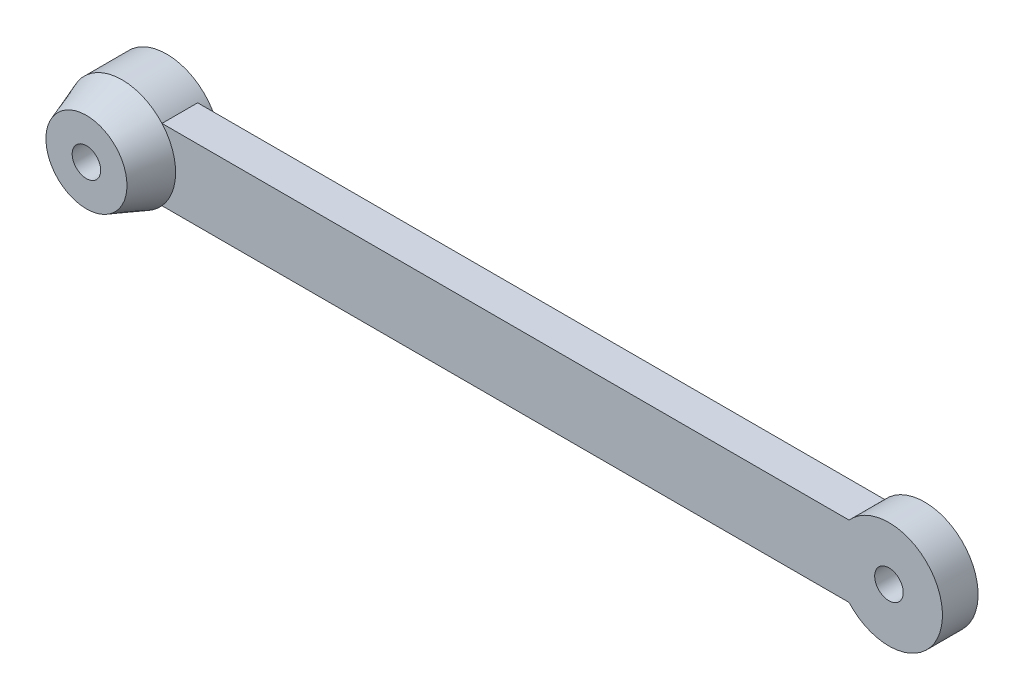
from build123d import *

# Parameters (mm, degrees)
SKETCH1_R             = 15
BOSS_EXTRUDE1_DEPTH   = 10
BOSS_EXTRUDE1_2_DEPTH = 10
SKETCH2_R             = 15
BOSS_EXTRUDE2_DEPTH   = 10
BOSS_EXTRUDE2_TAPER   = 20
BOSS_EXTRUDE3_DEPTH   = 5
BOSS_EXTRUDE4_DEPTH   = 5
SKETCH13_R            = 4
CUT_EXTRUDE1_DEPTH    = 20
BOSS_EXTRUDE7_START   = 2.5
SKETCH14_R            = 15
SKETCH14_R_2          = 4
BOSS_EXTRUDE7_DEPTH   = 2.5
ECHELLE1_SCALE        = 0.6


with BuildPart() as part:
    # Sketch1 → Boss-Extrude1 (new body)
    with BuildSketch(Plane.XY):
        Circle(SKETCH1_R)
    extrude(amount=BOSS_EXTRUDE1_DEPTH)

    # Sketch2 → Boss-Extrude2 (add)
    with BuildSketch(Plane.XY.offset(10)):
        Circle(SKETCH2_R)
    extrude(amount=BOSS_EXTRUDE2_DEPTH, taper=BOSS_EXTRUDE2_TAPER)



with BuildPart() as body_2:
    # Sketch1 → Boss-Extrude1 2 (new body)
    with BuildSketch(Plane.XY):
        with Locations((215, 0)):
            Circle(SKETCH1_R)
    extrude(amount=BOSS_EXTRUDE1_2_DEPTH)


with BuildPart() as part_1:
    add(part.part)

    add(body_2.part)  # Boss-Extrude3 merges body 2
    # Sketch5 → Boss-Extrude3 (add)
    with BuildSketch(Plane.XY):
        with BuildLine():
            Line((203.819660113, 10), (11.180339887, 10))
            ThreePointArc((11.180339887, 10), (14.012585384, 5.352331347), (15, 0))
            ThreePointArc((15, 0), (14.012585384, -5.352331347), (11.180339887, -10))
            Line((11.180339887, -10), (203.819660113, -10))
            ThreePointArc((203.819660113, -10), (200, 0), (203.819660113, 10))
        make_face()
    extrude(amount=BOSS_EXTRUDE3_DEPTH)

    # Sketch6 → Boss-Extrude4 (add)
    with BuildSketch(Plane.XY.offset(5)):
        with BuildLine():
            ThreePointArc((15, 0), (14.947457842, -1.254393904), (14.790199458, -2.5))
            ThreePointArc((14.790199458, -2.5), (13.515906498, -6.505403256), (11.180339887, -10))
            Line((11.180339887, -10), (203.819660113, -10))
            ThreePointArc((203.819660113, -10), (200, 0), (203.819660113, 10))
            Line((203.819660113, 10), (11.180339887, 10))
            ThreePointArc((11.180339887, 10), (13.515906498, 6.505403256), (14.790199458, 2.5))
            ThreePointArc((14.790199458, 2.5), (14.947457842, 1.254393904), (15, 0))
        make_face()
    extrude(amount=BOSS_EXTRUDE4_DEPTH)

    # Sketch13 → Cut-Extrude1 (cut)
    with BuildSketch(Plane(origin=(0, 0, 0), x_dir=(-1, 0, 0), z_dir=(0, 0, -1))):
        with Locations((-215, 0)):
            Circle(SKETCH13_R)
        Circle(SKETCH13_R)
    extrude(amount=-CUT_EXTRUDE1_DEPTH, mode=Mode.SUBTRACT)

    # Sketch14 → Boss-Extrude7 (add)
    with BuildSketch(Plane(origin=(0, 0, 0), x_dir=(-1, 0, 0), z_dir=(0, 0, -1)).offset(BOSS_EXTRUDE7_START)):
        Circle(SKETCH14_R)
        Circle(SKETCH14_R_2, mode=Mode.SUBTRACT)
    extrude(amount=-BOSS_EXTRUDE7_DEPTH)


with BuildPart() as part_2:
    # Echelle1: scaled about (95.047310585, 0, 5.648530127)
    add(part_1.part.scale(ECHELLE1_SCALE).moved(Location((38.018924234, 0, 2.259412051))))


solid = part_2.part
